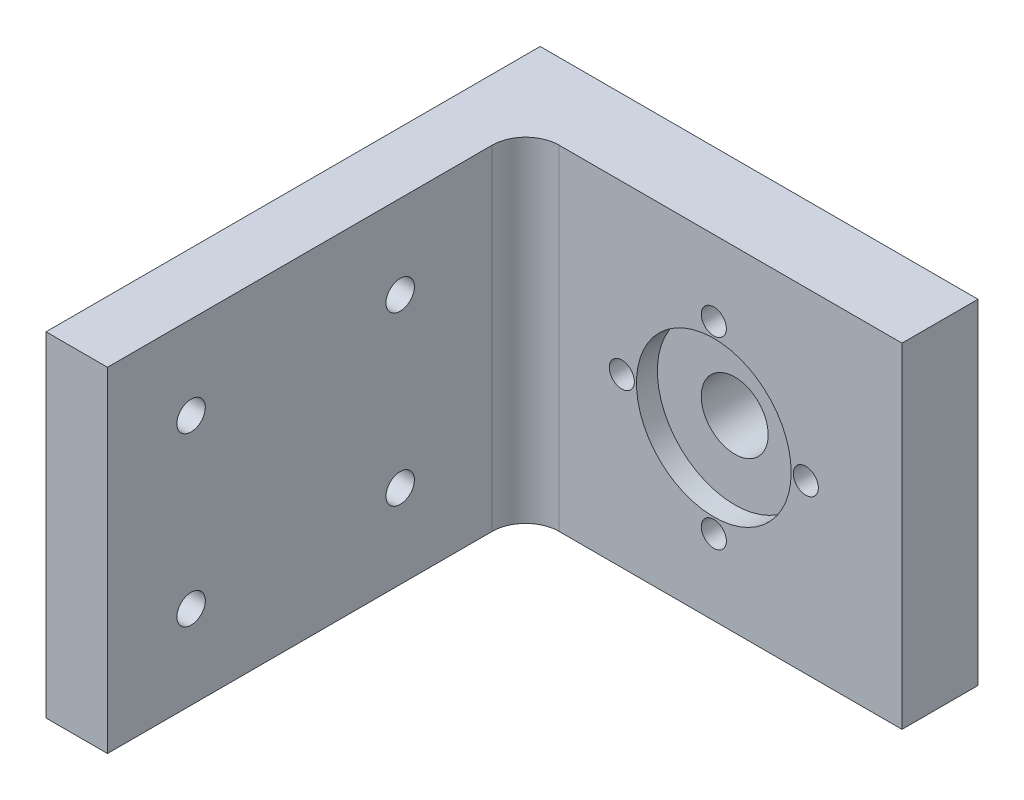
from build123d import *

# Parameters (mm, degrees)
SKETCH1_W           = 40
SKETCH1_H           = 45
BOSS_EXTRUDE1_DEPTH = 9.09
SKETCH2_R           = 1.5
CUT_EXTRUDE1_DEPTH  = 32.44643223
SKETCH3_R           = 9.25
CUT_EXTRUDE4_DEPTH  = 2.5
SKETCH4_R           = 4
CUT_EXTRUDE5_DEPTH  = 31.816847665
SKETCH5_W           = 40
SKETCH5_H           = 59.09
BOSS_EXTRUDE2_DEPTH = 7.35
SKETCH6_R           = 1.7
CUT_EXTRUDE6_DEPTH  = 77.919621034
FILLET1_R           = 4


with BuildPart() as part:
    # Sketch1 → Boss-Extrude1 (new body)
    with BuildSketch(Plane(origin=(0, 0, 0), x_dir=(0, 1, 0), z_dir=(0, 0, 1))):
        Rectangle(SKETCH1_W, SKETCH1_H)
    extrude(amount=BOSS_EXTRUDE1_DEPTH)

    # Sketch2 → Cut-Extrude1 (cut, through all)
    with BuildSketch(Plane.XY.offset(9.09)):
        with Locations((0, 11)):
            Circle(SKETCH2_R)
        with Locations((11, 0)):
            Circle(SKETCH2_R)
        with Locations((0, -11)):
            Circle(SKETCH2_R)
        with Locations((-11, 0)):
            Circle(SKETCH2_R)
    extrude(amount=-CUT_EXTRUDE1_DEPTH, mode=Mode.SUBTRACT)

    # Sketch3 → Cut-Extrude4 (cut)
    with BuildSketch(Plane.XY.offset(9.09)):
        Circle(SKETCH3_R)
    extrude(amount=-CUT_EXTRUDE4_DEPTH, mode=Mode.SUBTRACT)

    # Sketch4 → Cut-Extrude5 (cut, through all)
    with BuildSketch(Plane.XY.offset(6.59)):
        Circle(SKETCH4_R)
    extrude(amount=-CUT_EXTRUDE5_DEPTH, mode=Mode.SUBTRACT)

    # Sketch5 → Boss-Extrude2 (add)
    with BuildSketch(Plane(origin=(-22.5, 0, 0), x_dir=(0, -1, 0), z_dir=(-1, 0, 0))):
        with Locations((0, 29.545)):
            Rectangle(SKETCH5_W, SKETCH5_H)
    extrude(amount=BOSS_EXTRUDE2_DEPTH)

    # Sketch6 → Cut-Extrude6 (cut, through all)
    with BuildSketch(Plane.YZ.offset(-22.5)):
        with Locations(Location((-10, 49.09, 0), (0, 0, 270))):
            Circle(SKETCH6_R)
        with Locations(Location((10, 49.09, 0), (0, 0, 270))):
            Circle(SKETCH6_R)
        with Locations(Location((-10, 24.09, 0), (0, 0, 270))):
            Circle(SKETCH6_R)
        with Locations(Location((10, 24.09, 0), (0, 0, 270))):
            Circle(SKETCH6_R)
    extrude(amount=-CUT_EXTRUDE6_DEPTH, mode=Mode.SUBTRACT)

    # Fillet1
    fillet1_edges = [part.edges().sort_by_distance(p)[0] for p in [
        (-22.5, 0, 9.09),
    ]]
    fillet(fillet1_edges, radius=FILLET1_R)


solid = part.part
